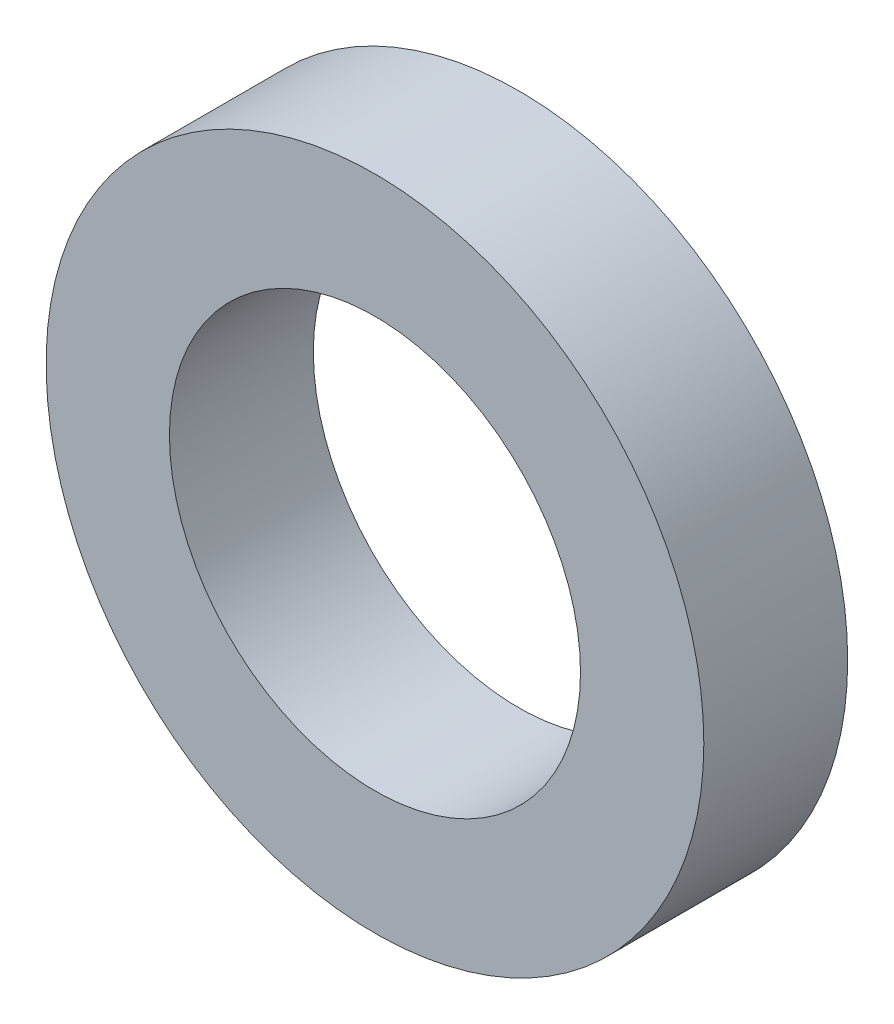
from build123d import *

# Parameters (mm, degrees)
SKETCH_1_R      = 16
SKETCH_1_R_2    = 10
EXTRUDE_1_DEPTH = 7


with BuildPart() as part:
    # Эскиз1 → Вытянуть1 (new body)
    with BuildSketch(Plane.XY):
        Circle(SKETCH_1_R)
        Circle(SKETCH_1_R_2, mode=Mode.SUBTRACT)
    extrude(amount=EXTRUDE_1_DEPTH)


solid = part.part
